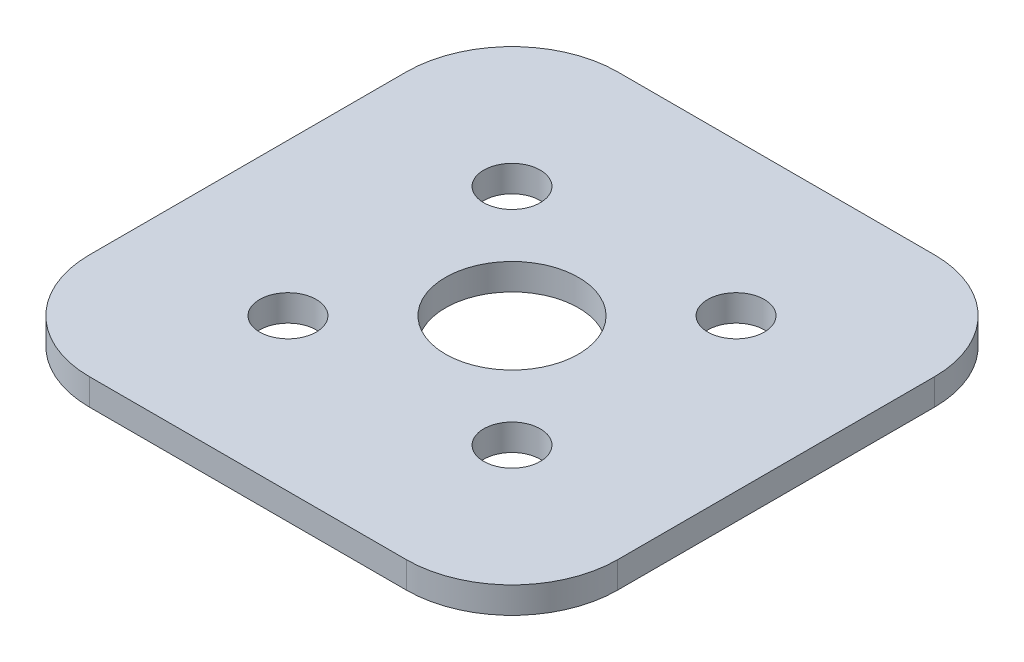
from build123d import *

# Parameters (mm, degrees)
SKETCH2_R           = 4
SKETCH2_R_2         = 1.700000029
BOSS_EXTRUDE1_DEPTH = 1.5875


with BuildPart() as part:
    # Sketch2 → Boss-Extrude1 (new body)
    with BuildSketch(Plane(origin=(0, 0, 0), x_dir=(1, 0, 0), z_dir=(0, 1, 0))):
        with BuildLine():
            Line((9.525, -15.875), (-9.525, -15.875))
            ThreePointArc((-9.525, -15.875), (-14.015128061, -14.015128061), (-15.875, -9.525))
            Line((-15.875, -9.525), (-15.875, 9.525))
            ThreePointArc((-15.875, 9.525), (-14.015128061, 14.015128061), (-9.525, 15.875))
            Line((-9.525, 15.875), (9.525, 15.875))
            ThreePointArc((9.525, 15.875), (14.015128061, 14.015128061), (15.875, 9.525))
            Line((15.875, 9.525), (15.875, -9.525))
            ThreePointArc((15.875, -9.525), (14.015128061, -14.015128061), (9.525, -15.875))
        make_face()
        with Locations(Location((0, 0, 0), (0, 0, 270))):
            Circle(SKETCH2_R, mode=Mode.SUBTRACT)
        with Locations(Location((-6.735192091, 6.735192091, 0), (0, 0, 270))):
            Circle(SKETCH2_R_2, mode=Mode.SUBTRACT)
        with Locations(Location((6.735192091, 6.735192091, 0), (0, 0, 270))):
            Circle(SKETCH2_R_2, mode=Mode.SUBTRACT)
        with Locations(Location((-6.735192091, -6.735192091, 0), (0, 0, 270))):
            Circle(SKETCH2_R_2, mode=Mode.SUBTRACT)
        with Locations(Location((6.735192091, -6.735192091, 0), (0, 0, 270))):
            Circle(SKETCH2_R_2, mode=Mode.SUBTRACT)
    extrude(amount=BOSS_EXTRUDE1_DEPTH)


solid = part.part
